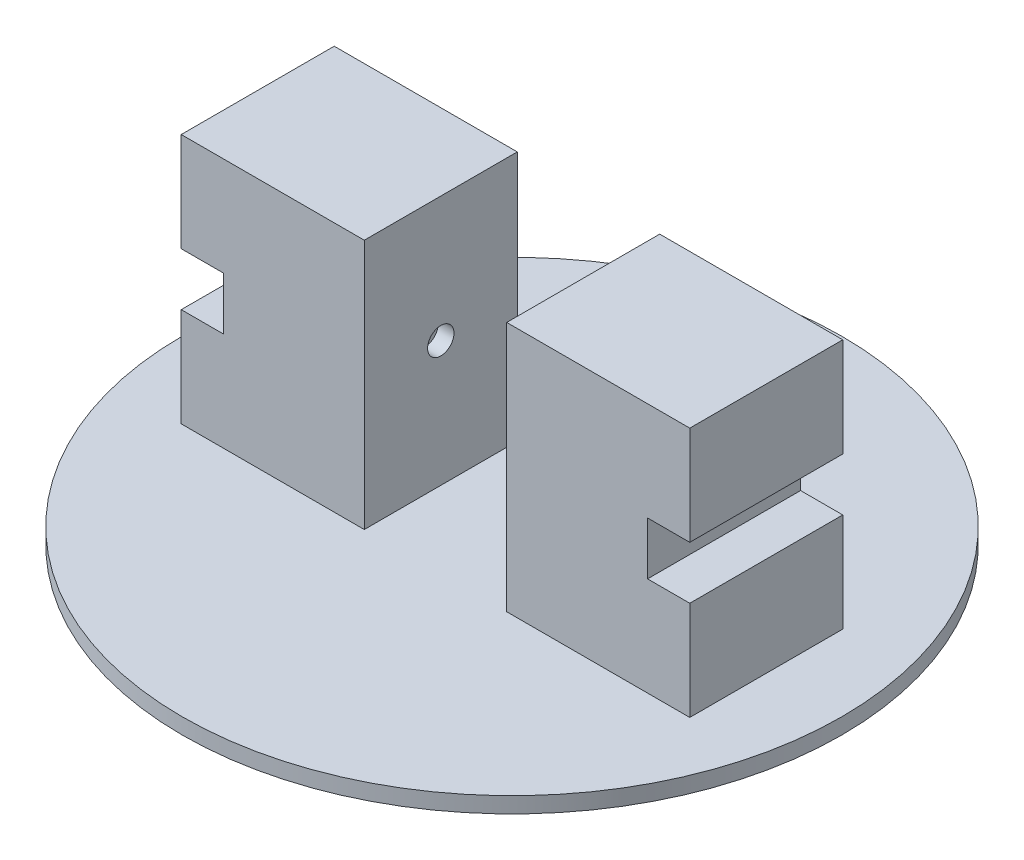
from build123d import *

# Parameters (mm, degrees)
SKETCH_1_W               = 34.7
SKETCH_1_H               = 47.5
EXTRUDE_1_DEPTH          = 29
EXTRUDE_1_2_DEPTH        = 29
SKETCH_2_W               = 29
SKETCH_2_H               = 10
CUT_EXTRUDE_1_DEPTH      = 8
SKETCH_3_W               = 29
SKETCH_3_H               = 10
CUT_EXTRUDE_2_DEPTH      = 8
SKETCH_4_R               = 62.5
EXTRUDE_2_DEPTH          = 3
CUT_EXTRUDE_3_DEPTH      = 22
CUT_EXTRUDE_3_DEPTH_BACK = 3
SKETCH_5_R               = 2.5
CUT_EXTRUDE_START        = -3
CUT_EXTRUDE_4_DEPTH      = 3


with BuildPart() as part:
    # 草图1 → 凸台-拉伸1 (new body)
    with BuildSketch(Plane.XY):
        with Locations((17.35, 23.75)):
            Rectangle(SKETCH_1_W, SKETCH_1_H)
    extrude(amount=EXTRUDE_1_DEPTH)

    # 草图2 → 切除-拉伸1 (cut)
    with BuildSketch(Plane(origin=(34.7, 0, 0), x_dir=(0, 0, -1), z_dir=(1, 0, 0))):
        with Locations((-14.5, 23.75)):
            Rectangle(SKETCH_2_W, SKETCH_2_H)
    extrude(amount=-CUT_EXTRUDE_1_DEPTH, mode=Mode.SUBTRACT)



with BuildPart() as body_2:
    # 草图1 → Extrude 1 2 (new body)
    with BuildSketch(Plane.XY):
        with Locations((-44.35, 23.75)):
            Rectangle(SKETCH_1_W, SKETCH_1_H)
    extrude(amount=EXTRUDE_1_2_DEPTH)

    # 草图3 → 切除-拉伸2 (cut)
    with BuildSketch(Plane.ZY.offset(61.7)):
        with Locations((14.5, 23.75)):
            Rectangle(SKETCH_3_W, SKETCH_3_H)
    extrude(amount=-CUT_EXTRUDE_2_DEPTH, mode=Mode.SUBTRACT)


with BuildPart() as part_1:
    add(part.part)

    add(body_2.part)  # 凸台-拉伸2 merges body 2
    # 草图4 → 凸台-拉伸2 (add)
    with BuildSketch(Plane.XZ):
        with Locations(Location((-13.5, 14.5, 0), (0, 0, 270))):
            Circle(SKETCH_4_R)
    extrude(amount=EXTRUDE_2_DEPTH)

    # 草图5 → 切除-拉伸3 (cut, two sides: drawn at the far end of the back side and taken through both)
    with BuildSketch(Plane(origin=(-27, 0, 0), x_dir=(0, 0, -1), z_dir=(1, 0, 0)).offset(-CUT_EXTRUDE_3_DEPTH_BACK)):
        with Locations(Location((-14.5, 23.75, 0), (0, 0, 180))):
            Circle(SKETCH_5_R)
    extrude(amount=CUT_EXTRUDE_3_DEPTH + CUT_EXTRUDE_3_DEPTH_BACK, mode=Mode.SUBTRACT)

    # 草图6 → 切除-拉伸4 (cut)
    with BuildSketch(Plane.ZY.offset(CUT_EXTRUDE_START)):
        with BuildLine():
            ThreePointArc((17, 23.75), (16.267766953, 25.517766953), (14.5, 26.25))
            Line((14.5, 26.25), (14.5, 23.75))
            Line((14.5, 23.75), (17, 23.75))
        make_face()
        with BuildLine():
            Line((14.5, 23.75), (14.5, 26.25))
            ThreePointArc((14.5, 26.25), (12.732233047, 25.517766953), (12, 23.75))
            Line((12, 23.75), (14.5, 23.75))
        make_face()
        with BuildLine():
            Line((17, 23.75), (14.5, 23.75))
            Line((14.5, 23.75), (14.5, 21.25))
            ThreePointArc((14.5, 21.25), (16.267766953, 21.982233047), (17, 23.75))
        make_face()
        with BuildLine():
            Line((14.5, 21.25), (14.5, 23.75))
            Line((14.5, 23.75), (12, 23.75))
            ThreePointArc((12, 23.75), (12.732233047, 21.982233047), (14.5, 21.25))
        make_face()
    extrude(amount=CUT_EXTRUDE_4_DEPTH, mode=Mode.SUBTRACT)


solid = part_1.part
